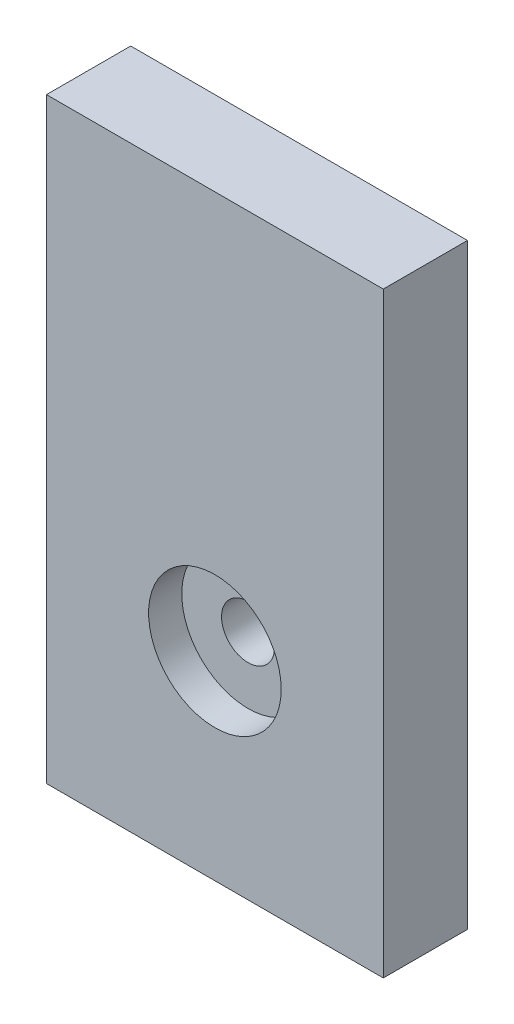
from build123d import *

# Parameters (mm, degrees)
CROQUIS1_W              = 50.8
CROQUIS1_H              = 80
CROQUIS1_R              = 4
SALIENTE_EXTRUIR1_DEPTH = 12.7
CROQUIS2_R              = 10
CORTAR_EXTRUIR1_DEPTH   = 5
CROQUIS3_W              = 50.8
CROQUIS3_H              = 12.7
SALIENTE_EXTRUIR2_DEPTH = 10


with BuildPart() as part:
    # Croquis1 → Saliente-Extruir1 (new body)
    with BuildSketch(Plane.XY):
        Rectangle(CROQUIS1_W, CROQUIS1_H)
        with Locations((0, -20)):
            Circle(CROQUIS1_R, mode=Mode.SUBTRACT)
    extrude(amount=SALIENTE_EXTRUIR1_DEPTH)

    # Croquis2 → Cortar-Extruir1 (cut)
    with BuildSketch(Plane.XY.offset(12.7)):
        with Locations((0, -20)):
            Circle(CROQUIS2_R)
    extrude(amount=-CORTAR_EXTRUIR1_DEPTH, mode=Mode.SUBTRACT)

    # Croquis3 → Saliente-Extruir2 (add)
    with BuildSketch(Plane.XZ.offset(40)):
        with Locations((0, 6.35)):
            Rectangle(CROQUIS3_W, CROQUIS3_H)
    extrude(amount=SALIENTE_EXTRUIR2_DEPTH)


solid = part.part
